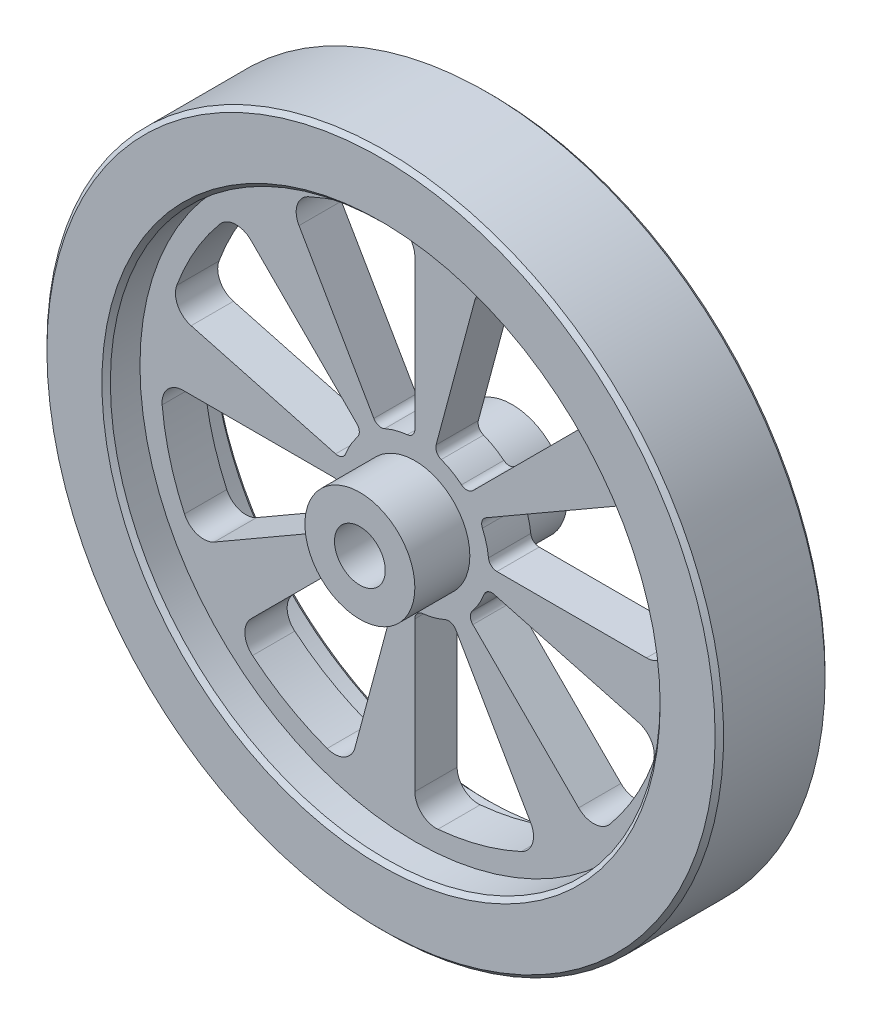
from build123d import *

# Parameters (mm, degrees)
SKETCH1_R           = 80
SKETCH1_R_2         = 6
BOSS_EXTRUDE1_DEPTH = 13
SKETCH2_R           = 65
CUT_EXTRUDE1_DEPTH  = 8
SKETCH5_R           = 13
SKETCH5_R_2         = 6
BOSS_EXTRUDE2_DEPTH = 18
CHAMFER1_SIZE       = 1
CUT_EXTRUDE2_DEPTH  = 116.451288429
CIRPATTERN1_COUNT   = 8


with BuildPart() as part:
    # Sketch1 → Boss-Extrude1 (new, symmetric)
    with BuildSketch(Plane.XY):
        with Locations(Location((0, 0, 0), (0, 0, 180))):
            Circle(SKETCH1_R)
        with Locations(Location((0, 0, 0), (0, 0, 180))):
            Circle(SKETCH1_R_2, mode=Mode.SUBTRACT)
    extrude(amount=BOSS_EXTRUDE1_DEPTH, both=True)

    # Sketch2 → Cut-Extrude1 (cut)
    with BuildSketch(Plane.XY.offset(13)):
        Circle(SKETCH2_R)
    cut_extrude1 = extrude(amount=-CUT_EXTRUDE1_DEPTH, mode=Mode.SUBTRACT)

    # Mirror1: Cut-Extrude1 across plane
    add(cut_extrude1.mirror(Plane.XY), mode=Mode.SUBTRACT)

    # Sketch5 → Boss-Extrude2 (add, symmetric)
    with BuildSketch(Plane.XY):
        with Locations(Location((0, 0, 0), (0, 0, 180))):
            Circle(SKETCH5_R)
        with Locations(Location((0, 0, 0), (0, 0, 180))):
            Circle(SKETCH5_R_2, mode=Mode.SUBTRACT)
    extrude(amount=BOSS_EXTRUDE2_DEPTH, both=True)

    # Chamfer1
    chamfer1_edges = [part.edges().sort_by_distance(p)[0] for p in [
        (-65, 0, 13),
        (-65, 0, -13),
        (80, 0, -13),
        (80, 0, 13),
    ]]
    chamfer(chamfer1_edges, length=CHAMFER1_SIZE)

    # Sketch7 → Cut-Extrude2 (cut, symmetric)
    with BuildSketch(Plane.XY.offset(5)):
        with BuildLine():
            Line((0, 54.772255751), (0, 19.397164741))
            ThreePointArc((0, 19.397164741), (-0.515032591, 18.057436487), (-1.794871795, 17.407711947))
            ThreePointArc((-1.794871795, 17.407711947), (-4.529333289, 16.90370196), (-7.149451403, 15.972956666))
            ThreePointArc((-7.149451403, 15.972956666), (-8.582686936, 15.895715021), (-9.698582371, 16.798437427))
            Line((-9.698582371, 16.798437427), (-27.386127875, 47.434164903))
            ThreePointArc((-27.386127875, 47.434164903), (-27.821744262, 51.446675992), (-25.152000934, 54.473634439))
            ThreePointArc((-25.152000934, 54.473634439), (-15.529142706, 57.955549577), (-5.454545455, 59.751551728))
            ThreePointArc((-5.454545455, 59.751551728), (-1.629000688, 58.46500048), (0, 54.772255751))
        make_face()
    cut_extrude2 = extrude(amount=CUT_EXTRUDE2_DEPTH, both=True, mode=Mode.SUBTRACT)

    # CirPattern1: Cut-Extrude2 ×8 about axis
    cirpattern1_axis = Axis((0, 0, 0), (0, 0, 1))
    for i in range(1, CIRPATTERN1_COUNT):
        add(cut_extrude2.rotate(cirpattern1_axis, i * 360 / CIRPATTERN1_COUNT), mode=Mode.SUBTRACT)


solid = part.part
